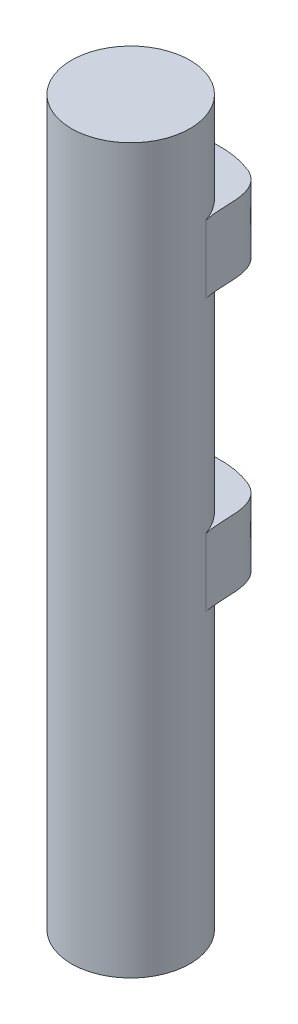
from build123d import *

# Parameters (mm, degrees)
SKETCH1_R           = 25.273
BOSS_EXTRUDE1_DEPTH = 203.2
CUT_EXTRUDE1_START  = -203.2
CUT_EXTRUDE1_DEPTH  = 203.2
SKETCH3_OUTSIDE_W   = 77.326
SKETCH3_OUTSIDE_H   = 85.949
SKETCH3_OUTSIDE_R   = 16.6497
CUT_EXTRUDE5_DEPTH  = 50.8
SKETCH4_OUTSIDE_W   = 77.326
SKETCH4_OUTSIDE_H   = 85.949
SKETCH4_OUTSIDE_R   = 16.6497
CUT_EXTRUDE6_DEPTH  = 57.15
SKETCH5_OUTSIDE_W   = 77.326
SKETCH5_OUTSIDE_H   = 85.949
SKETCH5_OUTSIDE_R   = 16.6497
CUT_EXTRUDE7_DEPTH  = 82.55


with BuildPart() as part:
    # Sketch1 → Boss-Extrude1 (new body)
    with BuildSketch(Plane(origin=(0, 0, 0), x_dir=(1, 0, 0), z_dir=(0, 1, 0))):
        with Locations(Location((0, 0, 0), (0, 0, 270))):
            Circle(SKETCH1_R)
    extrude(amount=BOSS_EXTRUDE1_DEPTH)

    # Sketch2 → Cut-Extrude1 (cut)
    with BuildSketch(Plane(origin=(0, 203.2, 0), x_dir=(1, 0, 0), z_dir=(0, 1, 0)).offset(CUT_EXTRUDE1_START)):
        with BuildLine():
            ThreePointArc((16.131428812, 4.121833886), (16.519624093, 2.077144651), (16.6497, 0))
            ThreePointArc((16.6497, 0), (-2.077144651, -16.519624093), (-16.131428812, 4.121833886))
            ThreePointArc((-16.131428812, 4.121833886), (-15.535644224, 5.988010406), (-14.724792916, 7.771292277))
            add(Edge.make_bspline(
                [(-14.724792916, 7.771292277), (-13.993112244, 11.833627294), (-14.951269099, 19.976611229), (-9.134694512, 23.553200783), (-6.765592548, 24.350591091)],
                knots=[0.117816193, 0.117816193, 0.117816193, 0.117816193, 0.459844437, 0.648405496, 0.648405496, 0.648405496, 0.648405496], degree=3))
            ThreePointArc((-6.765592548, 24.350591091), (-15.292771308, -20.121025688), (25.273, 0))
            ThreePointArc((25.273, 0), (21.007635157, 14.050046053), (9.651285593, 23.357594384))
            add(Edge.make_bspline(
                [(15.783143796, 5.301403776), (14.234187932, 11.657324188), (17.010518971, 19.800729125), (9.651285593, 23.357594384)],
                knots=[0.052591674, 0.052591674, 0.052591674, 0.052591674, 0.886528555, 0.886528555, 0.886528555, 0.886528555], degree=3))
            ThreePointArc((15.783143796, 5.301403776), (15.968181877, 4.714835907), (16.131428812, 4.121833886))
        make_face()
    extrude(amount=CUT_EXTRUDE1_DEPTH, mode=Mode.SUBTRACT)

    # Sketch3 outside → Cut-Extrude5 (cut)
    with BuildSketch(Plane(origin=(0, 177.8, 0), x_dir=(1, 0, 0), z_dir=(0, 1, 0))):
        with Locations((0, 4.3115)):
            Rectangle(SKETCH3_OUTSIDE_W, SKETCH3_OUTSIDE_H)
        with Locations(Location((0, 0, 0), (0, 0, 270))):
            Circle(SKETCH3_OUTSIDE_R, mode=Mode.SUBTRACT)
    extrude(amount=CUT_EXTRUDE5_DEPTH, mode=Mode.SUBTRACT)

    # Sketch4 outside → Cut-Extrude6 (cut)
    with BuildSketch(Plane(origin=(0, 101.6, 0), x_dir=(1, 0, 0), z_dir=(0, 1, 0))):
        with Locations((0, 4.3115)):
            Rectangle(SKETCH4_OUTSIDE_W, SKETCH4_OUTSIDE_H)
        with Locations(Location((0, 0, 0), (0, 0, 270))):
            Circle(SKETCH4_OUTSIDE_R, mode=Mode.SUBTRACT)
    extrude(amount=CUT_EXTRUDE6_DEPTH, mode=Mode.SUBTRACT)

    # Sketch5 outside → Cut-Extrude7 (cut)
    with BuildSketch(Plane(origin=(0, 0, 0), x_dir=(-1, 0, 0), z_dir=(0, -1, 0))):
        with Locations((0, 4.3115)):
            Rectangle(SKETCH5_OUTSIDE_W, SKETCH5_OUTSIDE_H)
        with Locations(Location((0, 0, 0), (0, 0, 270))):
            Circle(SKETCH5_OUTSIDE_R, mode=Mode.SUBTRACT)
    extrude(amount=-CUT_EXTRUDE7_DEPTH, mode=Mode.SUBTRACT)


solid = part.part
